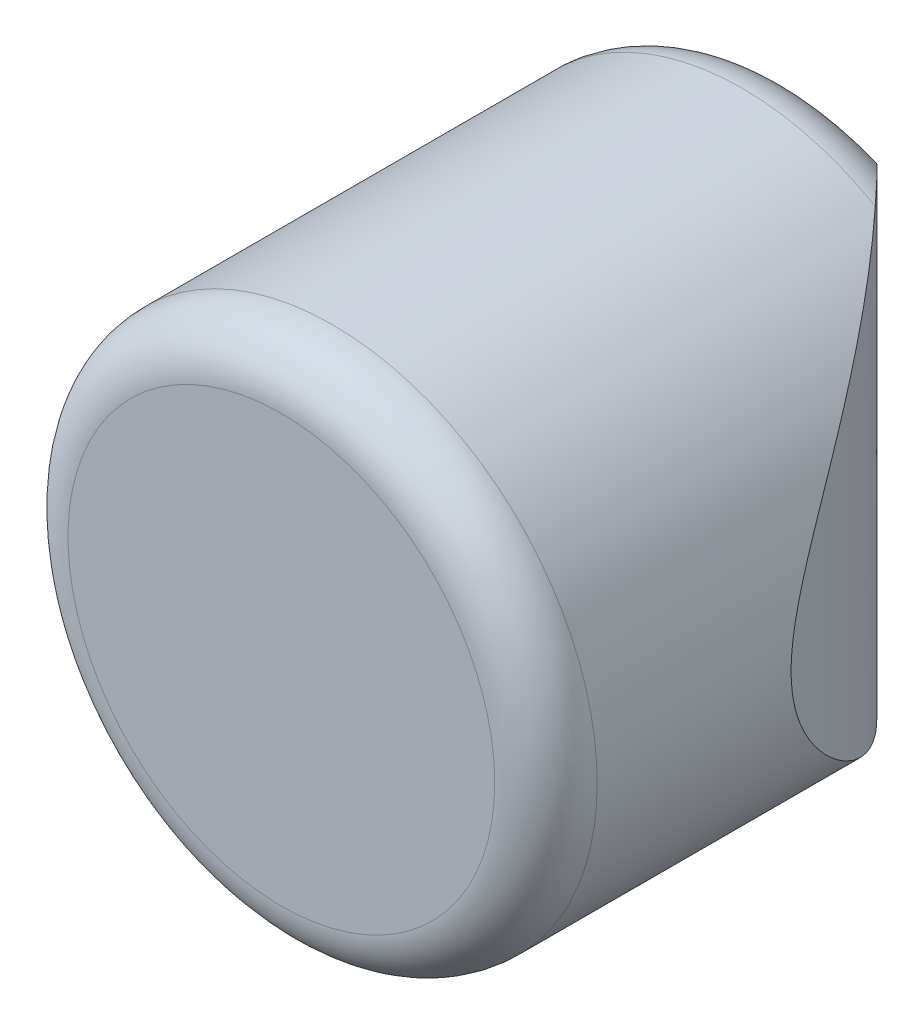
from build123d import *

# Parameters (mm, degrees)
SKETCH2_R               = 15.5
BOSS_EXTRUDE1_DEPTH     = 30
FILLET1_R               = 3
CUT_EXTRUDE1_DEPTH      = 20
CUT_EXTRUDE1_DEPTH_BACK = 20


with BuildPart() as part:
    # Sketch2 → Boss-Extrude1 (new body)
    with BuildSketch(Plane.XY):
        Circle(SKETCH2_R)
    extrude(amount=BOSS_EXTRUDE1_DEPTH)

    # Fillet1
    fillet1_edges = [part.edges().sort_by_distance(p)[0] for p in [
        (-15.5, 0, 30),
        (-15.5, 0, 0),
    ]]
    fillet(fillet1_edges, radius=FILLET1_R)

    # Sketch3 → Cut-Extrude1 (cut, two sides: drawn at the far end of the back side and taken through both)
    with BuildSketch(Plane(origin=(0, 0, 0), x_dir=(1, 0, 0), z_dir=(0, 1, 0)).offset(-CUT_EXTRUDE1_DEPTH_BACK)):
        with BuildLine():
            Line((4.854198749, 0), (19.206398093, 0))
            Line((19.206398093, 0), (19.206398093, -15.636699312))
            Line((19.206398093, -15.636699312), (15.5, -15.636699312))
            add(Edge.make_bspline(
                [(4.854198749, 0), (12.000659595, -6.632087606), (15.5, -15.636699312)],
                knots=[0, 0, 0, 1, 1, 1], degree=2))
        make_face()
    extrude(amount=CUT_EXTRUDE1_DEPTH + CUT_EXTRUDE1_DEPTH_BACK, mode=Mode.SUBTRACT)


solid = part.part
